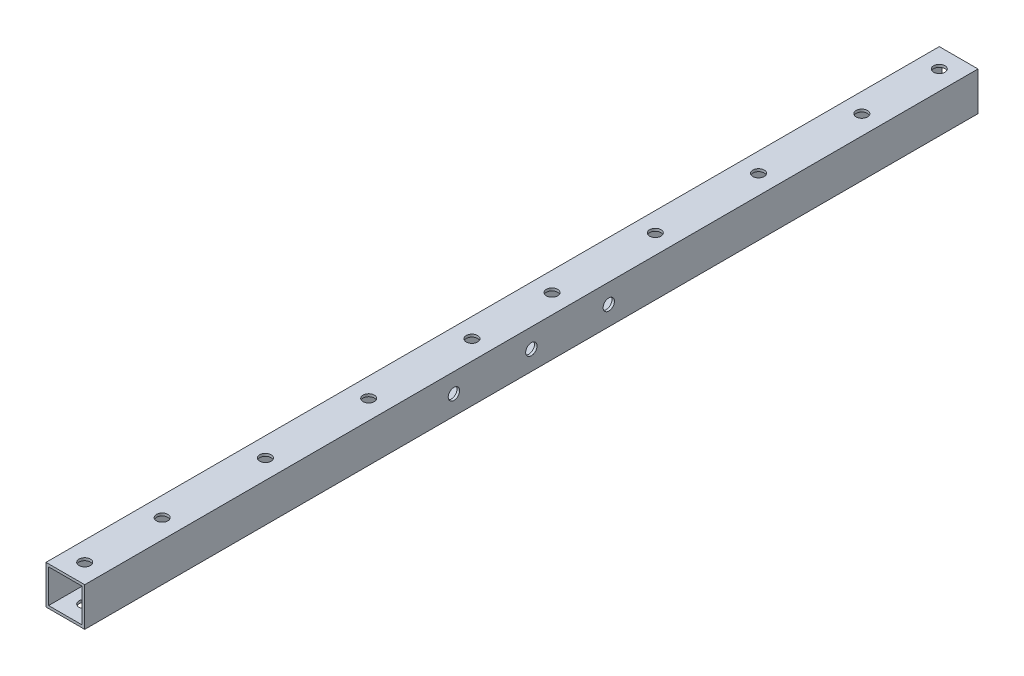
from build123d import *

# Parameters (mm, degrees)
SKETCH_1_W          = 15
SKETCH_1_H          = 15
SKETCH_1_W_2        = 13
SKETCH_1_H_2        = 13
EXTRUDE_1_DEPTH     = 346
SKETCH_3_R          = 2.2
CUT_EXTRUDE_2_DEPTH = 55
SKETCH_4_R          = 2.2
CUT_EXTRUDE_3_DEPTH = 55


with BuildPart() as part:
    # 草图1 → 凸台-拉伸1 (new body)
    with BuildSketch(Plane.XY):
        Rectangle(SKETCH_1_W, SKETCH_1_H)
        Rectangle(SKETCH_1_W_2, SKETCH_1_H_2, mode=Mode.SUBTRACT)
    extrude(amount=EXTRUDE_1_DEPTH)

    # 草图3 → 切除-拉伸2 (cut)
    with BuildSketch(Plane(origin=(0, 7.5, 0), x_dir=(1, 0, 0), z_dir=(0, 1, 0))):
        with Locations(Location((0, -338.5, 0), (0, 0, 270))):
            Circle(SKETCH_3_R)
        with Locations(Location((0, -7.5, 0), (0, 0, 270))):
            Circle(SKETCH_3_R)
        with Locations(Location((0, -37.5, 0), (0, 0, 270))):
            Circle(SKETCH_3_R)
        with Locations(Location((0, -308.5, 0), (0, 0, 270))):
            Circle(SKETCH_3_R)
        with Locations(Location((0, -77.5, 0), (0, 0, 270))):
            Circle(SKETCH_3_R)
        with Locations(Location((0, -117.5, 0), (0, 0, 270))):
            Circle(SKETCH_3_R)
        with Locations(Location((0, -228.5, 0), (0, 0, 270))):
            Circle(SKETCH_3_R)
        with Locations(Location((0, -268.5, 0), (0, 0, 270))):
            Circle(SKETCH_3_R)
        with Locations(Location((0, -157.5, 0), (0, 0, 270))):
            Circle(SKETCH_3_R)
        with Locations(Location((0, -188.5, 0), (0, 0, 270))):
            Circle(SKETCH_3_R)
    extrude(amount=-CUT_EXTRUDE_2_DEPTH, mode=Mode.SUBTRACT)

    # 草图4 → 切除-拉伸3 (cut)
    with BuildSketch(Plane(origin=(7.5, 0, 0), x_dir=(0, 0, -1), z_dir=(1, 0, 0))):
        with Locations((-173, 0)):
            Circle(SKETCH_4_R)
        with Locations((-203, 0)):
            Circle(SKETCH_4_R)
        with Locations((-143, 0)):
            Circle(SKETCH_4_R)
    extrude(amount=-CUT_EXTRUDE_3_DEPTH, mode=Mode.SUBTRACT)


solid = part.part
